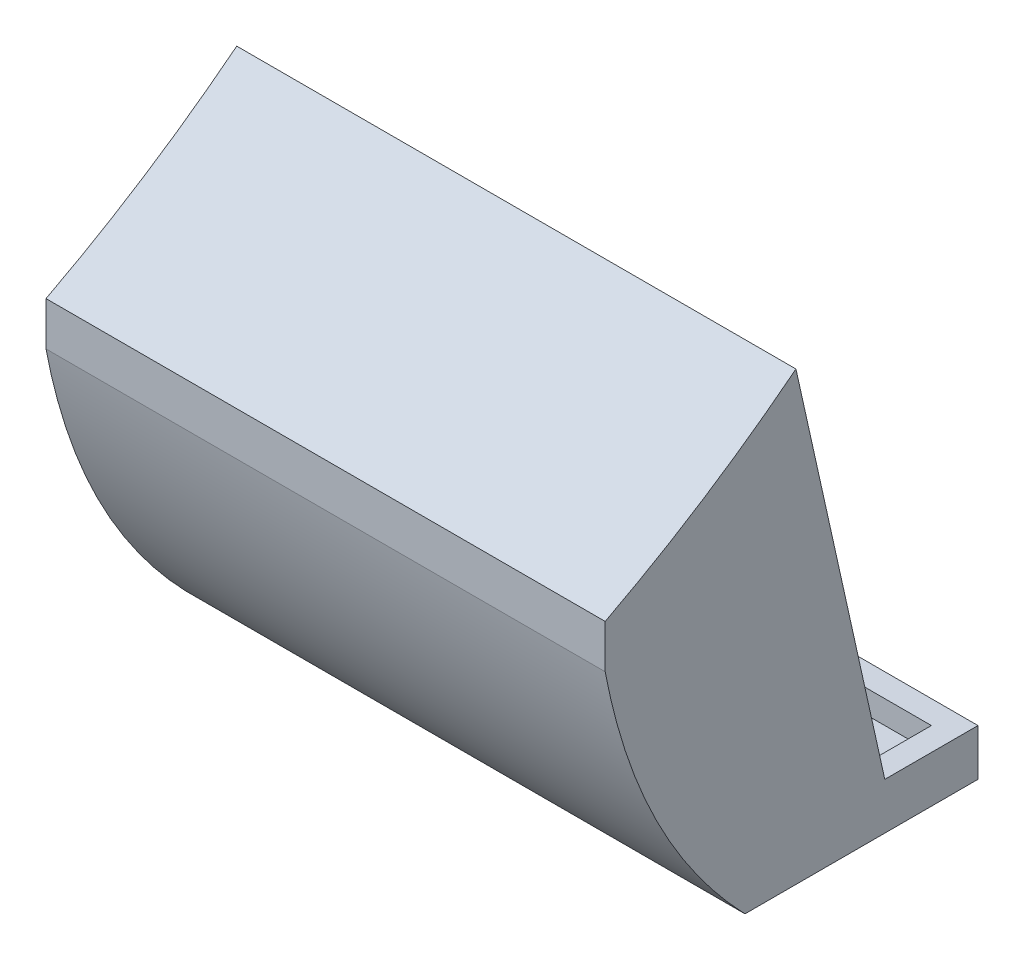
from build123d import *

# Parameters (mm, degrees)
SKETCH1_W           = 120
SKETCH1_H           = 80
BOSS_EXTRUDE1_DEPTH = 100
CUT_EXTRUDE1_DEPTH  = 176.499287748
SKETCH3_R           = 260
CUT_EXTRUDE2_DEPTH  = 176.499287919
SHELL1_T            = -5


with BuildPart() as part:
    # Sketch1 → Boss-Extrude1 (new body)
    with BuildSketch(Plane(origin=(0, 0, 0), x_dir=(1, 0, 0), z_dir=(0, 1, 0))):
        with Locations((60, 40)):
            Rectangle(SKETCH1_W, SKETCH1_H)
    extrude(amount=BOSS_EXTRUDE1_DEPTH)

    # Sketch2 → Cut-Extrude1 (cut, through all)
    with BuildSketch(Plane(origin=(120, 0, 0), x_dir=(0, 0, -1), z_dir=(1, 0, 0))):
        Polygon((80, 10), (60, 10), (40, 100), (80, 100), align=None)
        with BuildLine():
            Line((0, 60), (0, 0))
            Line((0, 0), (30, 0))
            add(Edge.make_bspline(
                [(0, 60), (6.797454451, 24.053758825), (30, 0)],
                knots=[0, 0, 0, 0.927202308, 0.927202308, 0.927202308], degree=2))
        make_face()
    extrude(amount=-CUT_EXTRUDE1_DEPTH, mode=Mode.SUBTRACT)

    # Sketch3 → Cut-Extrude2 (cut, through all)
    with BuildSketch(Plane(origin=(120, 0, 0), x_dir=(0, 0, -1), z_dir=(1, 0, 0))):
        with Locations((-120, 300)):
            Circle(SKETCH3_R)
    extrude(amount=-CUT_EXTRUDE2_DEPTH, mode=Mode.SUBTRACT)

    # Shell1
    shell1_openings = [part.faces().sort_by_distance(p)[0] for p in [
        (60, 10, -70),
        (60, 52.897059769, -50.467320051),
    ]]
    offset(amount=SHELL1_T, openings=shell1_openings, kind=Kind.INTERSECTION)


solid = part.part
